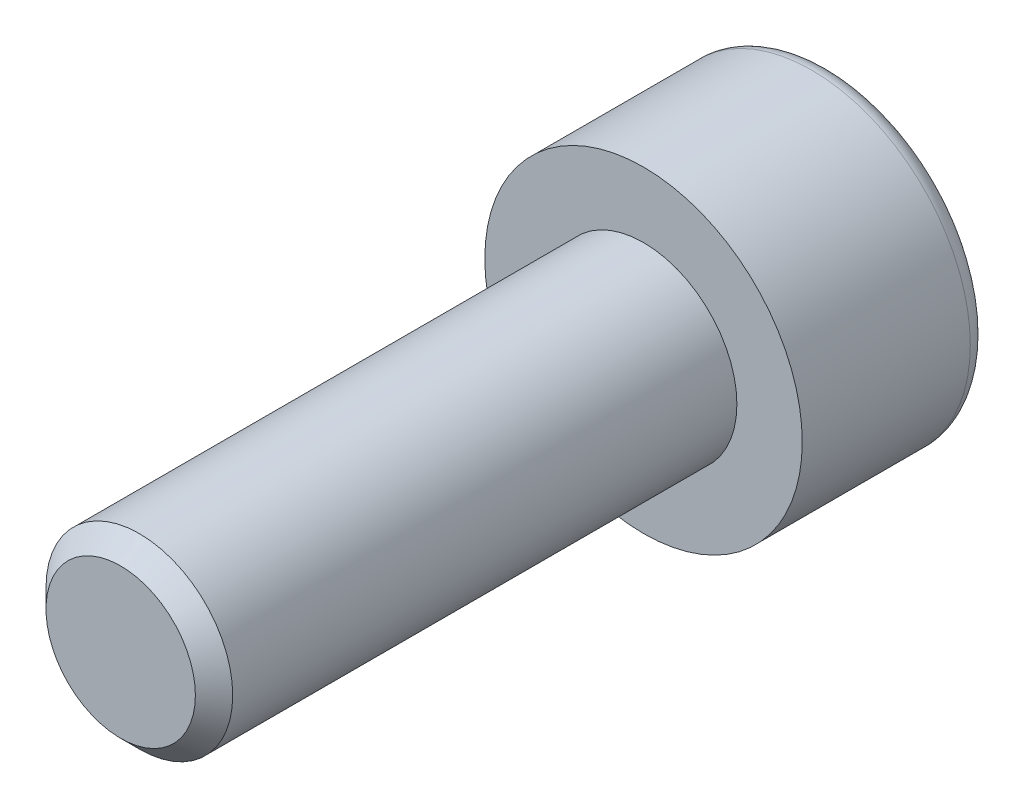
from build123d import *

# Parameters (mm, degrees)
ENLEV_MAT_EXTRU1_DEPTH = 2.5
ESQUISSE3_W            = 2.5
ESQUISSE3_H            = 14
CHANFREIN1_SIZE        = 0.5


with BuildPart() as part:
    # Esquisse1 → Base-Révolution (revolve)
    with BuildSketch(Plane(origin=(0, 0, 0), x_dir=(1, 0, 0), z_dir=(0, 1, 0)), mode=Mode.PRIVATE) as base_r_volution_sk:
        with BuildLine():
            Line((0, 0), (4.25, 0))
            Line((4.25, 0), (4.25, 4.5))
            ThreePointArc((4.25, 4.5), (4.103553391, 4.853553391), (3.75, 5))
            Line((3.75, 5), (0, 5))
            Line((0, 5), (0, 0))
        make_face()
    revolve(base_r_volution_sk.sketch.rotate(Axis((0, 0, 0), (0, 0, -1)), 180), axis=Axis((0, 0, 0), (0, 0, -1)))

    # Esquisse2 → enlev-mat-Extru1 (cut)
    with BuildSketch(Plane.XY.offset(-5)):
        Polygon((2, -1.154700538), (2, 1.154700538), (0, 2.309401077), (-2, 1.154700538), (-2, -1.154700538), (0, -2.309401077), align=None)
    extrude(amount=ENLEV_MAT_EXTRU1_DEPTH, mode=Mode.SUBTRACT)

    # Esquisse3 → Boss.-Révol.1 (revolve)
    with BuildSketch(Plane(origin=(0, 0, 0), x_dir=(1, 0, 0), z_dir=(0, 1, 0))):
        with Locations((1.25, -7)):
            Rectangle(ESQUISSE3_W, ESQUISSE3_H)
    revolve(axis=Axis((0, 0, 0), (0, 0, 1)))

    # Chanfrein1
    chanfrein1_edges = [part.edges().sort_by_distance(p)[0] for p in [
        (-2.5, 0, 14),
    ]]
    chamfer(chanfrein1_edges, length=CHANFREIN1_SIZE)


solid = part.part
